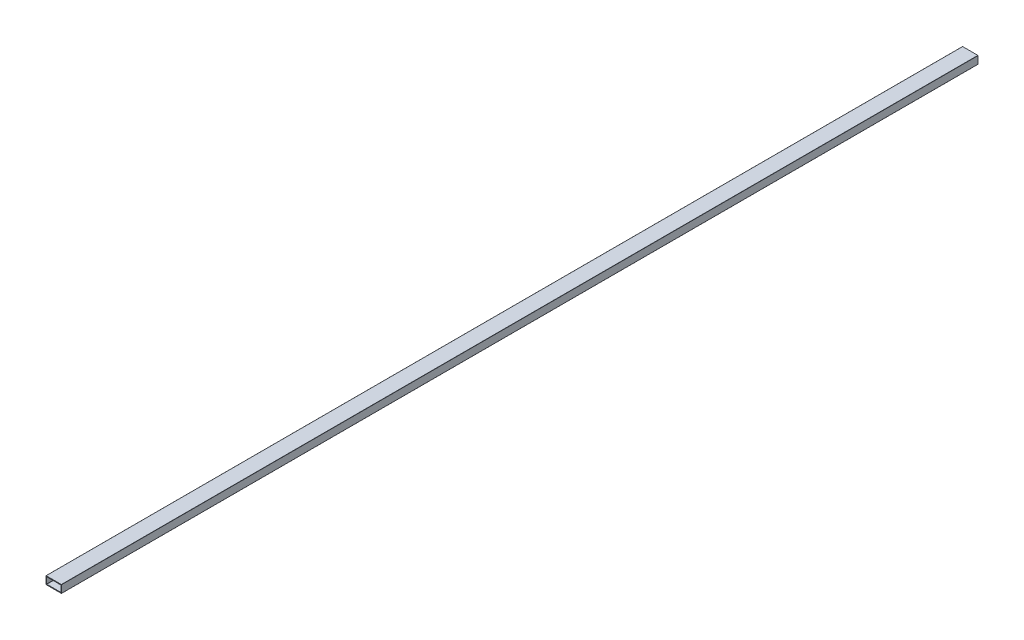
from build123d import *

# Parameters (mm, degrees)
CROQUIS1_W              = 101.6
CROQUIS1_H              = 50.8
CROQUIS1_W_2            = 92.5
CROQUIS1_H_2            = 41.7
SALIENTE_EXTRUIR1_DEPTH = 6000
REDONDEO1_R             = 1


with BuildPart() as part:
    # Croquis1 → Saliente-Extruir1 (new body)
    with BuildSketch(Plane.XY):
        Rectangle(CROQUIS1_W, CROQUIS1_H)
        Rectangle(CROQUIS1_W_2, CROQUIS1_H_2, mode=Mode.SUBTRACT)
    extrude(amount=-SALIENTE_EXTRUIR1_DEPTH)

    # Redondeo1
    redondeo1_edges = [part.edges().sort_by_distance(p)[0] for p in [
        (46.25, -20.85, -3000),
        (-46.25, -20.85, -3000),
        (-46.25, 20.85, -3000),
        (46.25, 20.85, -3000),
        (50.8, -25.4, -3000),
        (-50.8, -25.4, -3000),
        (-50.8, 25.4, -3000),
        (50.8, 25.4, -3000),
    ]]
    fillet(redondeo1_edges, radius=REDONDEO1_R)


solid = part.part
